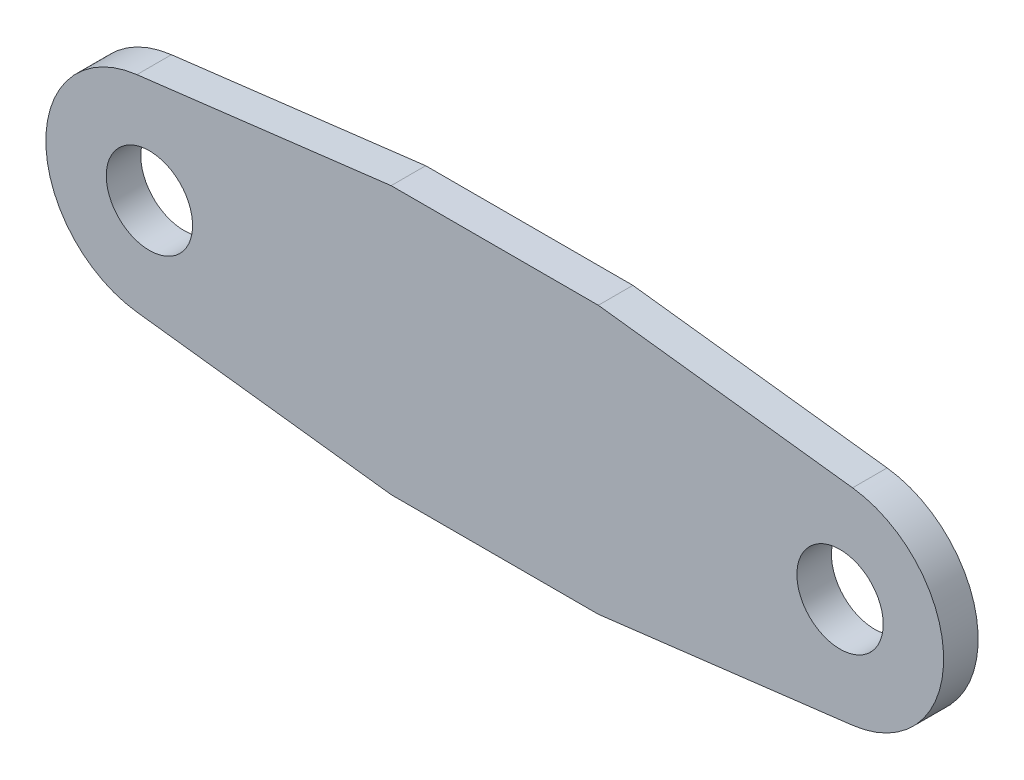
from build123d import *

# Parameters (mm, degrees)
CROQUIS1_R              = 1.25
SALIENTE_EXTRUIR1_DEPTH = 1


with BuildPart() as part:
    # Croquis1 → Saliente-Extruir1 (new body)
    with BuildSketch(Plane.XY):
        with BuildLine():
            Line((3, 3.875), (10.362810685, 2.977980592))
            ThreePointArc((10.362810685, 2.977980592), (13, 0), (10.362810685, -2.977980592))
            Line((10.362810685, -2.977980592), (3, -3.875))
            Line((3, -3.875), (-3, -3.875))
            Line((-3, -3.875), (-10.362810685, -2.977980592))
            ThreePointArc((-10.362810685, -2.977980592), (-13, 0), (-10.362810685, 2.977980592))
            Line((-10.362810685, 2.977980592), (-3, 3.875))
            Line((-3, 3.875), (3, 3.875))
        make_face()
        with Locations((10, 0)):
            Circle(CROQUIS1_R, mode=Mode.SUBTRACT)
        with Locations(Location((-10, 0, 0), (0, 0, 180))):
            Circle(CROQUIS1_R, mode=Mode.SUBTRACT)
    extrude(amount=SALIENTE_EXTRUIR1_DEPTH)


solid = part.part
